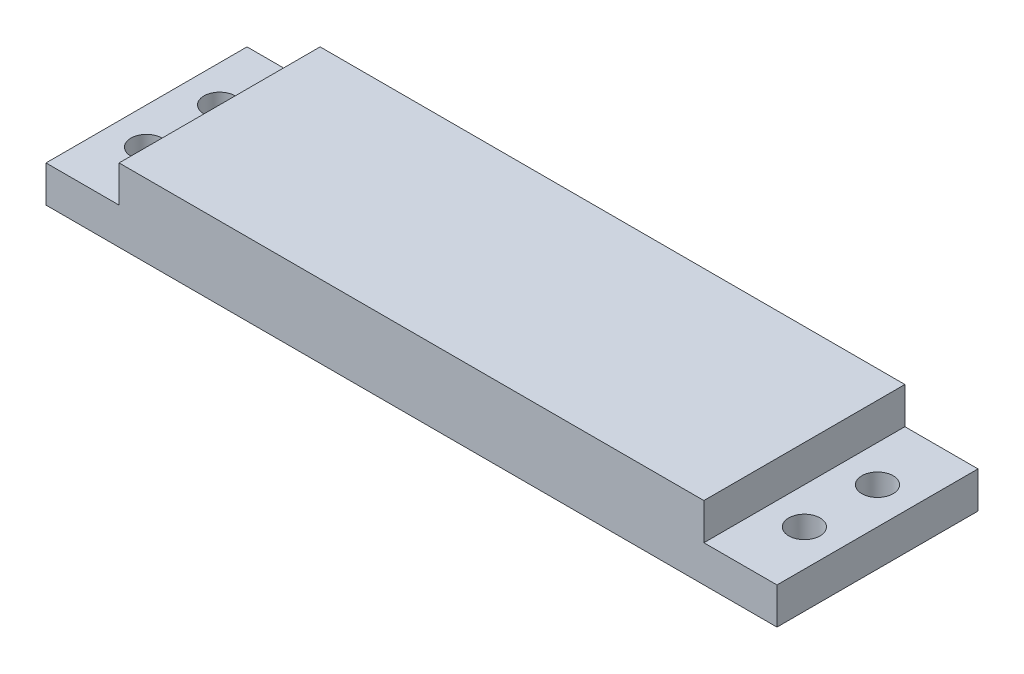
from build123d import *

# Parameters (mm, degrees)
SKETCH1_W           = 63.5
SKETCH1_H           = 17.4625
BOSS_EXTRUDE1_DEPTH = 6.35
SKETCH2_W           = 6.35
SKETCH2_H           = 3.175
CUT_EXTRUDE1_DEPTH  = 67.1627645
SKETCH3_R           = 1.357929869
CUT_EXTRUDE2_DEPTH  = 67.1627645


with BuildPart() as part:
    # Sketch1 → Boss-Extrude1 (new body)
    with BuildSketch(Plane(origin=(0, 0, 0), x_dir=(1, 0, 0), z_dir=(0, 1, 0))):
        with Locations((-31.75, 8.73125)):
            Rectangle(SKETCH1_W, SKETCH1_H)
    extrude(amount=BOSS_EXTRUDE1_DEPTH)

    # Sketch2 → Cut-Extrude1 (cut, through all)
    with BuildSketch(Plane.XY):
        with Locations((-3.175, 4.7625)):
            Rectangle(SKETCH2_W, SKETCH2_H)
        with Locations((-60.325, 4.7625)):
            Rectangle(SKETCH2_W, SKETCH2_H)
    extrude(amount=-CUT_EXTRUDE1_DEPTH, mode=Mode.SUBTRACT)

    # Sketch3 → Cut-Extrude2 (cut, through all)
    with BuildSketch(Plane(origin=(0, 6.35, 0), x_dir=(1, 0, 0), z_dir=(0, 1, 0))):
        with Locations(Location((-60.325, 11.90625, 0), (0, 0, 270))):
            Circle(SKETCH3_R)
        with Locations(Location((-60.325, 5.55625, 0), (0, 0, 90))):
            Circle(SKETCH3_R)
        with Locations(Location((-3.175, 5.55625, 0), (0, 0, 270))):
            Circle(SKETCH3_R)
        with Locations(Location((-3.175, 11.90625, 0), (0, 0, 90))):
            Circle(SKETCH3_R)
    extrude(amount=-CUT_EXTRUDE2_DEPTH, mode=Mode.SUBTRACT)


solid = part.part
